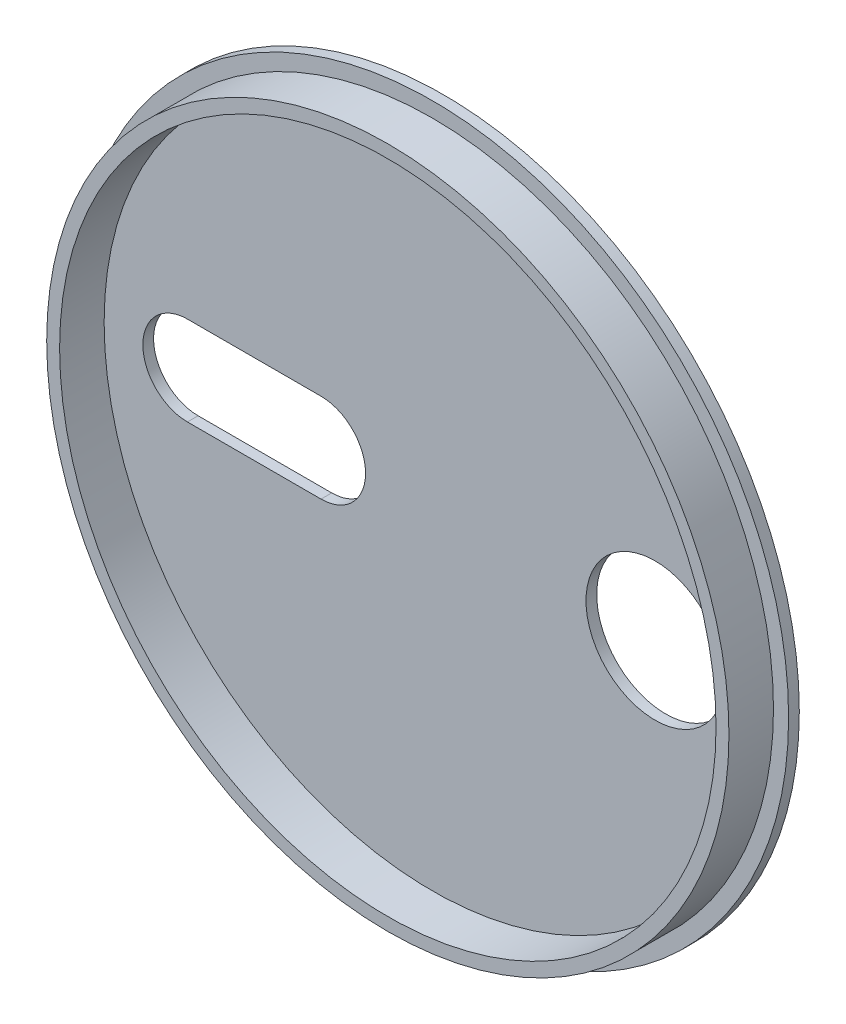
from build123d import *

# Parameters (mm, degrees)
SKETCH1_R           = 40
BOSS_EXTRUDE1_DEPTH = 1.2
CUT_EXTRUDE1_REACH  = 58.581
SKETCH2_R           = 7.75
CUT_EXTRUDE2_REACH  = 58.581
SKETCH4_R           = 38.3
BOSS_EXTRUDE2_DEPTH = 5
SKETCH5_R           = 36.85
CUT_EXTRUDE3_DEPTH  = 5


with BuildPart() as part:
    # Sketch1 → Boss-Extrude1 (new body)
    with BuildSketch(Plane.XY):
        Circle(SKETCH1_R)
    extrude(amount=BOSS_EXTRUDE1_DEPTH)

    # Sketch2 → Cut-Extrude1 (cut, up to next)
    with BuildSketch(Plane.XY.offset(1.2), mode=Mode.PRIVATE) as cut_extrude1_sk1:
        with Locations((25, 0)):
            Circle(SKETCH2_R)
    cut_extrude1_tool1 = extrude(cut_extrude1_sk1.sketch, amount=-CUT_EXTRUDE1_REACH, mode=Mode.PRIVATE) & part.part
    add(cut_extrude1_tool1.solids().sort_by_distance((25, 0, 1.2))[0], mode=Mode.SUBTRACT)

    # Sketch3 → Cut-Extrude2 (cut, up to next)
    with BuildSketch(Plane.XY.offset(1.2), mode=Mode.PRIVATE) as cut_extrude2_sk1:
        with BuildLine():
            Line((-27.5, 5), (-12.5, 5))
            ThreePointArc((-12.5, 5), (-7.5, 0), (-12.5, -5))
            Line((-12.5, -5), (-27.5, -5))
            ThreePointArc((-27.5, -5), (-32.5, 0), (-27.5, 5))
        make_face()
    cut_extrude2_tool1 = extrude(cut_extrude2_sk1.sketch, amount=-CUT_EXTRUDE2_REACH, mode=Mode.PRIVATE) & part.part
    add(cut_extrude2_tool1.solids().sort_by_distance((-20, 0, 1.2))[0], mode=Mode.SUBTRACT)

    # Sketch4 → Boss-Extrude2 (add)
    with BuildSketch(Plane.XY.offset(1.2)):
        Circle(SKETCH4_R)
    extrude(amount=BOSS_EXTRUDE2_DEPTH)

    # Sketch5 → Cut-Extrude3 (cut)
    with BuildSketch(Plane.XY.offset(6.2)):
        Circle(SKETCH5_R)
    extrude(amount=-CUT_EXTRUDE3_DEPTH, mode=Mode.SUBTRACT)


solid = part.part
